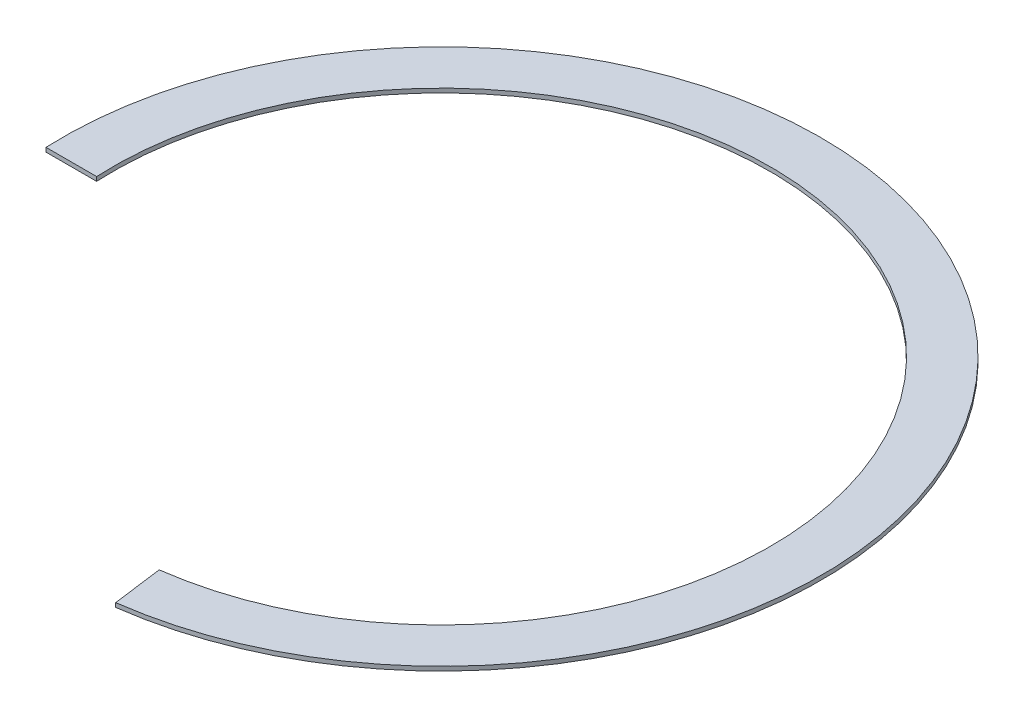
from build123d import *

# Parameters (mm, degrees)
BOSS_EXTRUDE1_DEPTH = 0.7


with BuildPart() as part:
    # Sketch1 → Boss-Extrude1 (new body)
    with BuildSketch(Plane(origin=(0, 0, 0), x_dir=(1, 0, 0), z_dir=(0, 1, 0))):
        with BuildLine():
            Line((-63.429423616, -2.772781942), (-54.960099893, -2.772781942))
            ThreePointArc((-54.960099893, -2.772781942), (35.192639001, 42.305780458), (7.278215875, -54.546571603))
            Line((7.278215875, -54.546571603), (8.397127492, -62.932252064))
            ThreePointArc((8.397127492, -62.932252064), (40.766761774, 48.672900412), (-63.429423616, -2.772781942))
        make_face()
    extrude(amount=BOSS_EXTRUDE1_DEPTH)


solid = part.part
